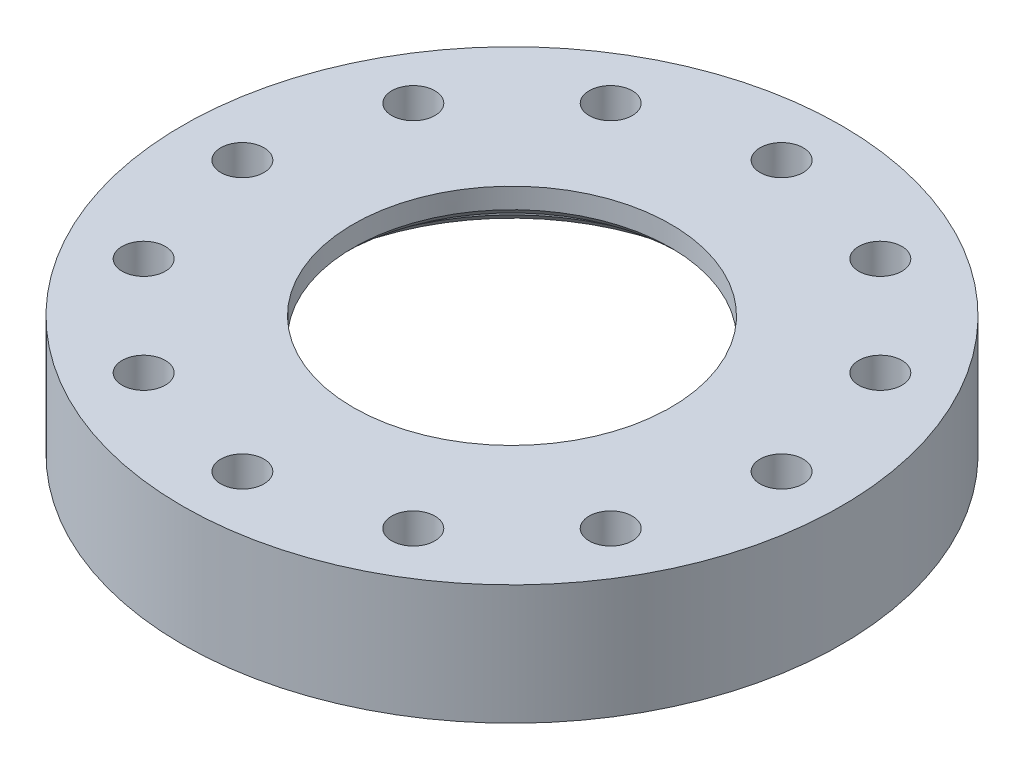
from build123d import *

# Parameters (mm, degrees)
M3_CLEARANCE_HOLE1_D = 3.6
CHAMFER1_SIZE        = 0.8


with BuildPart() as part:
    # Sketch1 → Revolve1 (revolve)
    with BuildSketch(Plane.XY, mode=Mode.PRIVATE) as revolve1_sk:
        Polygon((-25.75, 0), (-27.5, 0), (-27.5, 10), (-13.25, 10), (-13.25, 7.5), (-16.25, 7.5), (-16.25, 5), (-19.25, 5), (-19.25, 7), (-25.75, 7), align=None)
    revolve(revolve1_sk.sketch.rotate(Axis((0, 0, 0), (0, -1, 0)), 270), axis=Axis((0, 0, 0), (0, -1, 0)))

    # M3 Clearance Hole1 (through all)
    with Locations(Plane(origin=(0, 10, 0), x_dir=(1, 0, 0), z_dir=(0, 1, 0))):
        with Locations((-22.5, 0), (-19.485571585, 11.25), (-11.25, 19.485571585), (0, 22.5), (11.25, 19.485571585), (19.485571585, 11.25), (22.5, 0), (19.485571585, -11.25), (11.25, -19.485571585), (0, -22.5), (-11.25, -19.485571585), (-19.485571585, -11.25)):
            Hole(M3_CLEARANCE_HOLE1_D / 2)

    # Chamfer1
    chamfer1_edges = [part.edges().sort_by_distance(p)[0] for p in [
        (0, 7.5, -13.25),
        (0, 5, -16.25),
    ]]
    chamfer(chamfer1_edges, length=CHAMFER1_SIZE)


solid = part.part
